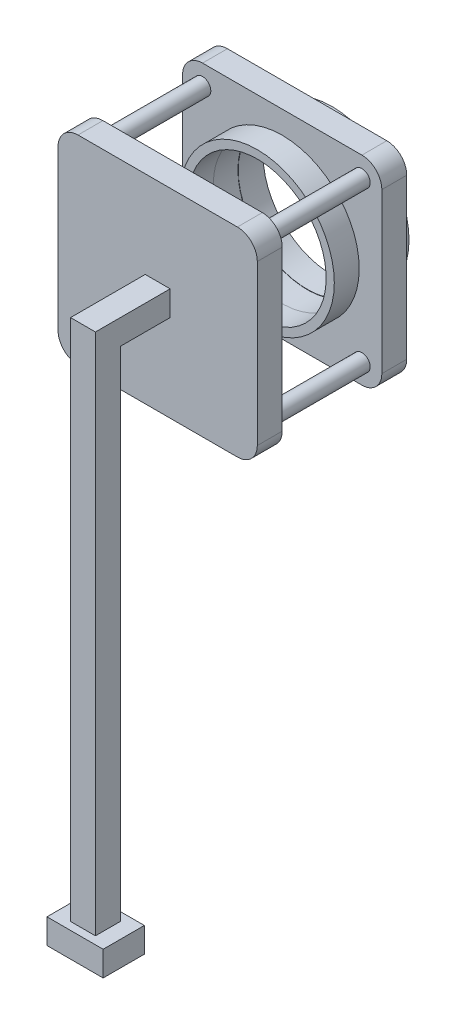
from build123d import *

# Parameters (mm, degrees)
SKETCH1_W           = 40
SKETCH1_H           = 40
BOSS_EXTRUDE1_DEPTH = 5
SKETCH3_R           = 13.891
CUT_EXTRUDE1_DEPTH  = 57.789083458
SKETCH4_R           = 1.664017503
BOSS_EXTRUDE3_DEPTH = 20
SKETCH5_W           = 5
SKETCH5_H           = 5
BOSS_EXTRUDE4_DEPTH = 15
SKETCH6_W           = 5
SKETCH6_H           = 5
BOSS_EXTRUDE5_DEPTH = 100
SKETCH7_R           = 15.460977434
SKETCH7_R_2         = 13.828216596
BOSS_EXTRUDE6_DEPTH = 5
SKETCH8_W           = 11.277313534
SKETCH8_H           = 8.274115908
BOSS_EXTRUDE7_DEPTH = 5
FILLET1_R           = 4
FILLET2_R           = 4


with BuildPart() as part:
    # Sketch1 → Boss-Extrude1 (new body)
    with BuildSketch(Plane.XY):
        with Locations((20, -20)):
            Rectangle(SKETCH1_W, SKETCH1_H)
    boss_extrude1 = extrude(amount=BOSS_EXTRUDE1_DEPTH)

    # Sketch3 → Cut-Extrude1 (cut, through all)
    with BuildSketch(Plane(origin=(0, 0, 0), x_dir=(-1, 0, 0), z_dir=(0, 0, -1))):
        with Locations((-20, -20)):
            Circle(SKETCH3_R)
    extrude(amount=-CUT_EXTRUDE1_DEPTH, mode=Mode.SUBTRACT)

    # Sketch4 → Boss-Extrude3 (add)
    with BuildSketch(Plane.XY.offset(5)):
        with Locations((4, -4)):
            Circle(SKETCH4_R)
        with Locations((36, -4)):
            Circle(SKETCH4_R)
        with Locations((36, -36)):
            Circle(SKETCH4_R)
        with Locations((4, -36)):
            Circle(SKETCH4_R)
    extrude(amount=BOSS_EXTRUDE3_DEPTH)

    # Mirror1: Boss-Extrude1 across plane
    add(boss_extrude1.mirror(Plane.XY.offset(15)))

    # Sketch5 → Boss-Extrude4 (add)
    with BuildSketch(Plane.XY.offset(30)):
        with Locations((20, -20)):
            Rectangle(SKETCH5_W, SKETCH5_H)
    extrude(amount=BOSS_EXTRUDE4_DEPTH)

    # Sketch6 → Boss-Extrude5 (add)
    with BuildSketch(Plane.XZ.offset(22.5)):
        with Locations((20, 42.5)):
            Rectangle(SKETCH6_W, SKETCH6_H)
    extrude(amount=BOSS_EXTRUDE5_DEPTH)

    # Sketch7 → Boss-Extrude6 (add)
    with BuildSketch(Plane(origin=(0, 0, 0), x_dir=(-1, 0, 0), z_dir=(0, 0, -1))):
        with Locations(Location((-20, -20, 0), (0, 0, 180))):
            Circle(SKETCH7_R)
        with Locations((-20, -20)):
            Circle(SKETCH7_R_2, mode=Mode.SUBTRACT)
    boss_extrude6 = extrude(amount=BOSS_EXTRUDE6_DEPTH)

    # Mirror3: Boss-Extrude6 across plane
    add(boss_extrude6.mirror(Plane.XY.offset(2.5)))

    # Sketch8 → Boss-Extrude7 (add)
    with BuildSketch(Plane.XZ.offset(122.5)):
        with Locations((19.966542914, 42.419592184)):
            Rectangle(SKETCH8_W, SKETCH8_H)
    extrude(amount=BOSS_EXTRUDE7_DEPTH)

    # Fillet1
    fillet1_edges = [part.edges().sort_by_distance(p)[0] for p in [
        (0, 0, 2.5),
    ]]
    fillet(fillet1_edges, radius=FILLET1_R)

    # Fillet2
    fillet2_edges = [part.edges().sort_by_distance(p)[0] for p in [
        (0, -40, 27.5),
        (0, 0, 27.5),
        (40, 0, 27.5),
        (40, -40, 27.5),
        (40, 0, 2.5),
        (40, -40, 2.5),
        (0, -40, 2.5),
    ]]
    fillet(fillet2_edges, radius=FILLET2_R)


solid = part.part
